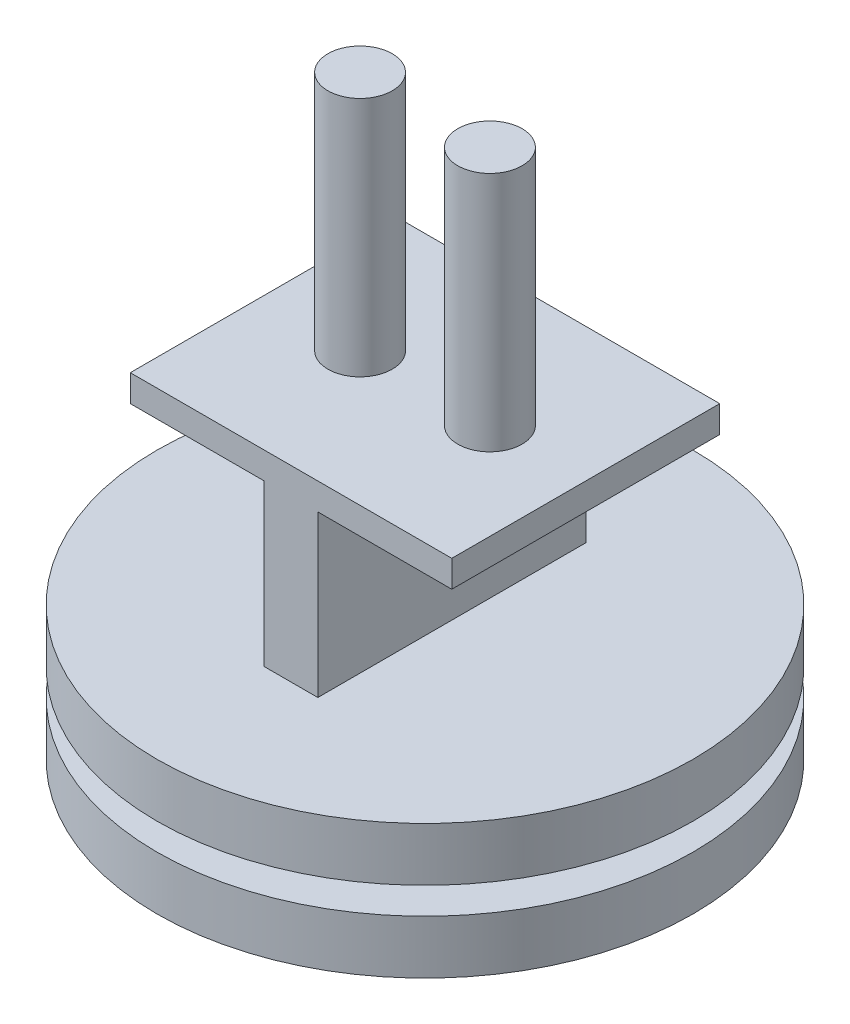
from build123d import *

# Parameters (mm, degrees)
SKETCH_1_R      = 50
EXTRUDE_1_DEPTH = 10
SKETCH_2_R      = 10
EXTRUDE_2_DEPTH = 5
SKETCH_3_R      = 50
EXTRUDE_3_DEPTH = 10
SKETCH_4_W      = 10
SKETCH_4_H      = 50
EXTRUDE_4_DEPTH = 30
SKETCH_5_W      = 60
SKETCH_5_H      = 50
EXTRUDE_5_DEPTH = 5
SKETCH_6_R      = 6
EXTRUDE_6_DEPTH = 45


with BuildPart() as part:
    # 草图1 → 凸台-拉伸1 (new body)
    with BuildSketch(Plane(origin=(0, 0, 0), x_dir=(1, 0, 0), z_dir=(0, 1, 0))):
        with Locations(Location((0, 0, 0), (0, 0, 270))):
            Circle(SKETCH_1_R)
    extrude(amount=EXTRUDE_1_DEPTH)

    # 草图2 → 凸台-拉伸2 (add)
    with BuildSketch(Plane(origin=(0, 10, 0), x_dir=(1, 0, 0), z_dir=(0, 1, 0))):
        with Locations(Location((0, 0, 0), (0, 0, 270))):
            Circle(SKETCH_2_R)
    extrude(amount=EXTRUDE_2_DEPTH)

    # 草图3 → 凸台-拉伸3 (add)
    with BuildSketch(Plane(origin=(0, 15, 0), x_dir=(1, 0, 0), z_dir=(0, 1, 0))):
        with Locations(Location((0, 0, 0), (0, 0, 270))):
            Circle(SKETCH_3_R)
    extrude(amount=EXTRUDE_3_DEPTH)

    # 草图4 → 凸台-拉伸4 (add)
    with BuildSketch(Plane(origin=(0, 25, 0), x_dir=(1, 0, 0), z_dir=(0, 1, 0))):
        Rectangle(SKETCH_4_W, SKETCH_4_H)
    extrude(amount=EXTRUDE_4_DEPTH)

    # 草图5 → 凸台-拉伸5 (add)
    with BuildSketch(Plane(origin=(0, 55, 0), x_dir=(1, 0, 0), z_dir=(0, 1, 0))):
        Rectangle(SKETCH_5_W, SKETCH_5_H)
    extrude(amount=EXTRUDE_5_DEPTH)

    # 草图6 → 凸台-拉伸6 (add)
    with BuildSketch(Plane(origin=(0, 60, 0), x_dir=(1, 0, 0), z_dir=(0, 1, 0))):
        with Locations(Location((12.118185601, 0, 0), (0, 0, 90))):
            Circle(SKETCH_6_R)
        with Locations(Location((-12.118185601, 0, 0), (0, 0, 90))):
            Circle(SKETCH_6_R)
    extrude(amount=EXTRUDE_6_DEPTH)


solid = part.part
